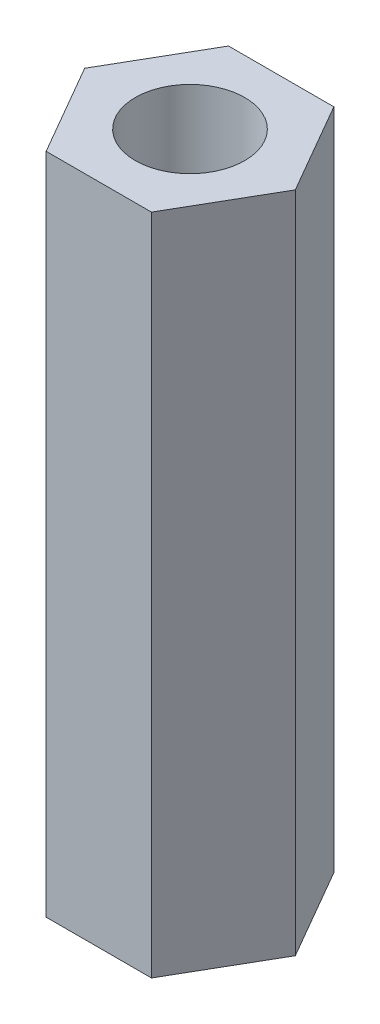
from build123d import *

# Parameters (mm, degrees)
SKETCH1_R           = 1.65
BOSS_EXTRUDE1_DEPTH = 20


with BuildPart() as part:
    # Sketch1 → Boss-Extrude1 (new body)
    with BuildSketch(Plane(origin=(0, 0, 0), x_dir=(1, 0, 0), z_dir=(0, 1, 0))):
        Polygon((1.58771324, 2.75), (-1.58771324, 2.75), (-3.175426481, 0), (-1.58771324, -2.75), (1.58771324, -2.75), (3.175426481, 0), align=None)
        with Locations(Location((0, 0, 0), (0, 0, 270))):
            Circle(SKETCH1_R, mode=Mode.SUBTRACT)
    extrude(amount=BOSS_EXTRUDE1_DEPTH)


solid = part.part
